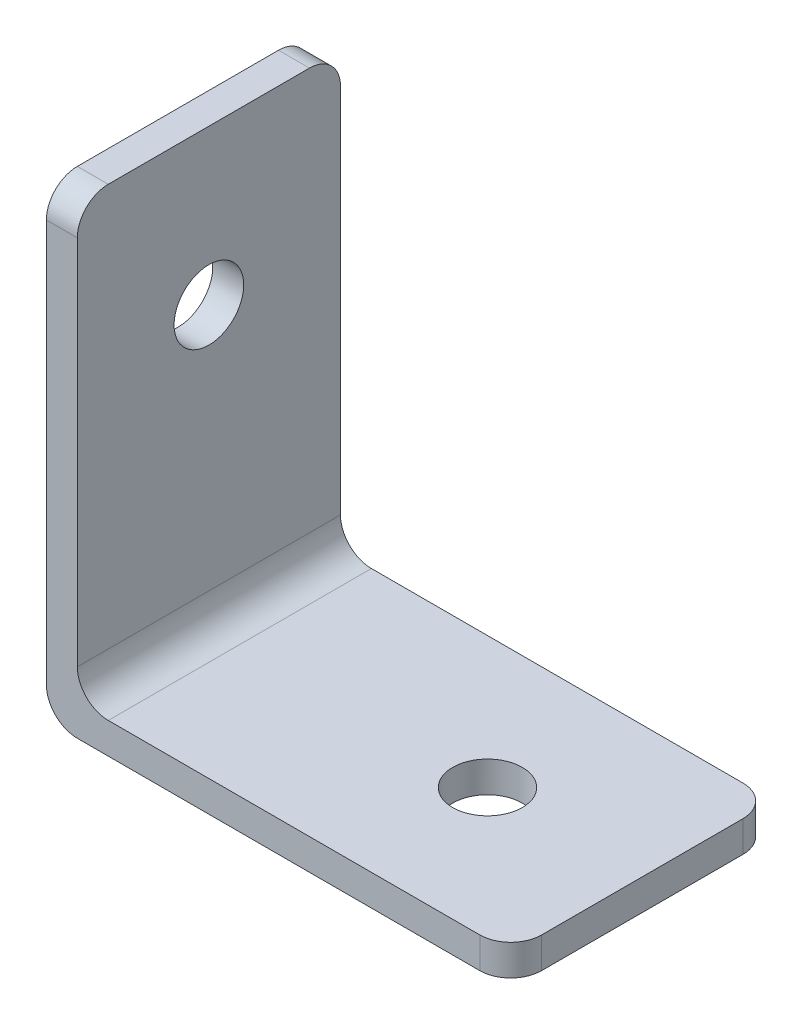
from build123d import *

# Parameters (mm, degrees)
EXTRUDE_THIN1_DEPTH = 17
FILLET1_R           = 2
FILLET2_R           = 2
SKETCH2_R           = 2.25
CUT_EXTRUDE1_DEPTH  = 10
SKETCH4_R           = 2.25
CUT_EXTRUDE2_DEPTH  = 10


with BuildPart() as part:
    # Sketch1 → Extrude-Thin1 (new body)
    with BuildSketch(Plane.XY):
        Polygon((0, 30), (0, 0), (30, 0), (30, 2), (2, 2), (2, 30), align=None)
    extrude(amount=EXTRUDE_THIN1_DEPTH)

    # Fillet1
    fillet1_edges = [part.edges().sort_by_distance(p)[0] for p in [
        (1, 30, 17),
        (1, 30, 0),
        (30, 1, 0),
        (30, 1, 17),
    ]]
    fillet(fillet1_edges, radius=FILLET1_R)

    # Fillet2
    fillet2_edges = [part.edges().sort_by_distance(p)[0] for p in [
        (0, 0, 8.5),
        (2, 2, 8.5),
    ]]
    fillet(fillet2_edges, radius=FILLET2_R)

    # Sketch2 → Cut-Extrude1 (cut)
    with BuildSketch(Plane.ZY):
        with Locations((8.5, 20)):
            Circle(SKETCH2_R)
    extrude(amount=-CUT_EXTRUDE1_DEPTH, mode=Mode.SUBTRACT)

    # Sketch4 → Cut-Extrude2 (cut)
    with BuildSketch(Plane.XZ):
        with Locations(Location((20, 8.5, 0), (0, 0, 270))):
            Circle(SKETCH4_R)
    extrude(amount=-CUT_EXTRUDE2_DEPTH, mode=Mode.SUBTRACT)


solid = part.part
